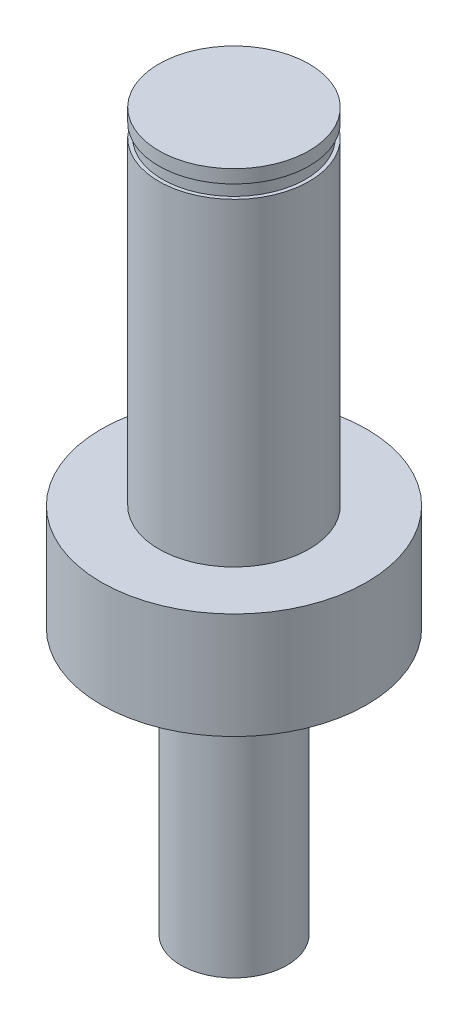
from build123d import *


with BuildPart() as part:
    # Sketch1 → Revolve1 (revolve)
    with BuildSketch(Plane.XY, mode=Mode.PRIVATE) as revolve1_sk:
        Polygon((0, 81), (0, 0), (6, 0), (6, 30), (15, 30), (15, 42), (8.5, 42), (8.5, 78), (8.1, 78), (8.1, 79.5), (8.5, 79.5), (8.5, 81), align=None)
    revolve(revolve1_sk.sketch.rotate(Axis((0, 0, 0), (0, 1, 0)), 90), axis=Axis((0, 0, 0), (0, 1, 0)))


solid = part.part
